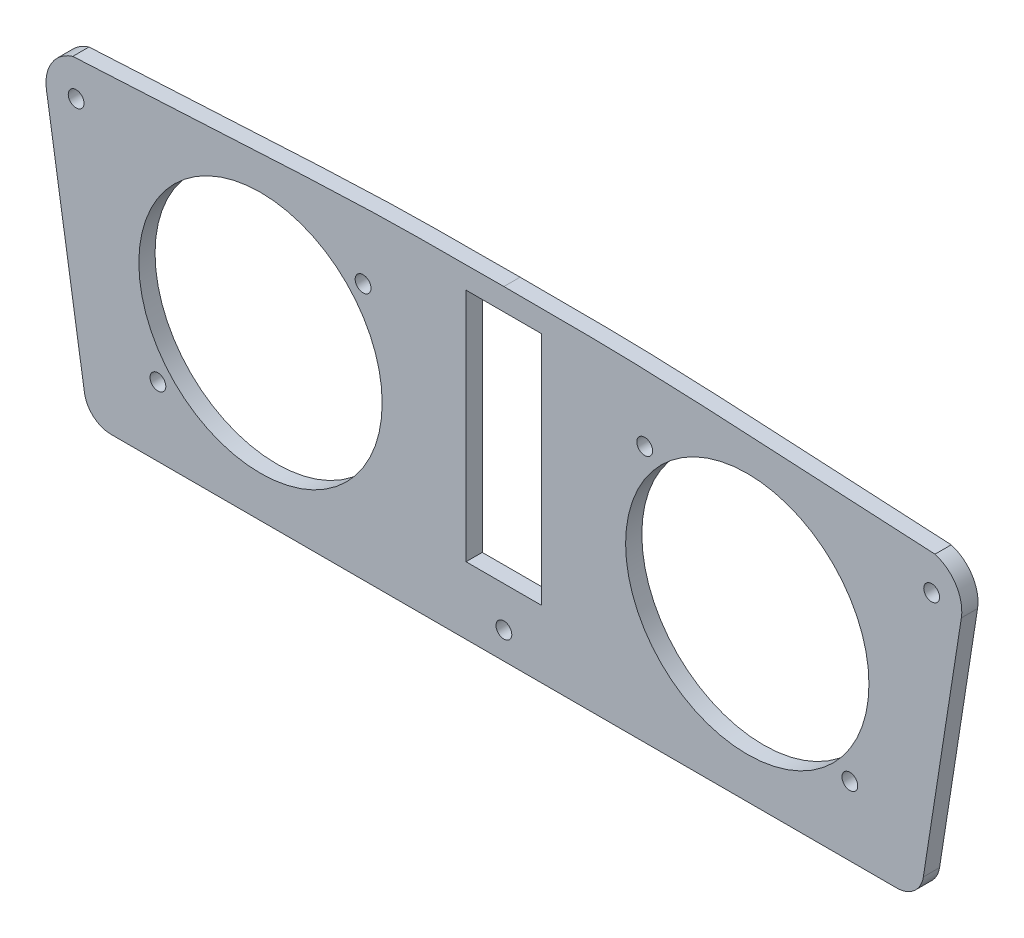
from build123d import *

# Parameters (mm, degrees)
SALIENTE_EXTRUIR3_DEPTH     = 3
CROQUIS12_R                 = 22.5
CORTAR_EXTRUIR1_DEPTH       = 3
TALADRO_DE_MARGEN_PARA_32_D = 2.921
TALADRO_DE_MARGEN_PARA_33_D = 2.921
TALADRO_DE_MARGEN_PARA_34_D = 2.921
CORTAR_EXTRUIR2_DEPTH       = 10


with BuildPart() as part:
    # Croquis1 → Saliente-Extruir3 (new body)
    with BuildSketch(Plane.XY):
        with BuildLine():
            Line((72.6209879, -42.713924632), (-72.6209879, -42.713924632))
            ThreePointArc((-72.6209879, -42.713924632), (-75.872299777, -41.512473181), (-77.561094305, -38.485513064))
            Line((-77.561094305, -38.485513064), (-84.58908741, 6.511317248))
            ThreePointArc((-84.58908741, 6.511317248), (-83.604933224, 11.307915351), (-79.718228228, 14.286075368))
            add(Edge.make_bspline(
                [(-79.718228228, 14.286075368), (-25, 17.286075368), (0, 17.286075368)],
                knots=[0, 0, 0, 1, 1, 1], degree=2, weights=[1, 3, 1]))
            add(Edge.make_bspline(
                [(79.718228228, 14.286075368), (25, 17.286075368), (0, 17.286075368)],
                knots=[0, 0, 0, 1, 1, 1], degree=2, weights=[1, 3, 1]))
            ThreePointArc((79.718228228, 14.286075368), (83.604933224, 11.307915351), (84.58908741, 6.511317248))
            Line((84.58908741, 6.511317248), (77.561094305, -38.485513064))
            ThreePointArc((77.561094305, -38.485513064), (75.872299777, -41.512473181), (72.6209879, -42.713924632))
        make_face()
    extrude(amount=SALIENTE_EXTRUIR3_DEPTH)

    # Croquis12 → Cortar-Extruir1 (cut)
    with BuildSketch(Plane.XY.offset(3)):
        with Locations((-45.004967788, -12.63149749)):
            Circle(CROQUIS12_R)
        with Locations((45.004967788, -12.63149749)):
            Circle(CROQUIS12_R)
    extrude(amount=-CORTAR_EXTRUIR1_DEPTH, mode=Mode.SUBTRACT)

    # Taladro de margen para #32 (through all)
    with Locations(Plane(origin=(-26.037185737, 4.709587945, 0), x_dir=(-1, 0, 0), z_dir=(0, 0, -1))):
        with Locations((0, 0), (37.935564102, -34.682170869), (-52.074371474, 0), (-90.009935576, -34.682170869)):
            Hole(TALADRO_DE_MARGEN_PARA_32_D / 2)

    # Taladro de margen para #33 (through all)
    with Locations(Plane(origin=(0, -37.713924632, 0), x_dir=(-1, 0, 0), z_dir=(0, 0, -1))):
        with Locations((0, 0)):
            Hole(TALADRO_DE_MARGEN_PARA_33_D / 2)

    # Taladro de margen para #34 (through all)
    with Locations(Plane(origin=(79.096485455, 7.800604527, 0), x_dir=(-1, 0, 0), z_dir=(0, 0, -1))):
        with Locations((0, 0), (158.19297091, 0)):
            Hole(TALADRO_DE_MARGEN_PARA_34_D / 2)

    # Croquis16 → Cortar-Extruir2 (cut)
    with BuildSketch(Plane.XY.offset(3)):
        Polygon((0, 13.210639363), (-7, 13.210639363), (-7, -30.288459084), (7, -30.288459084), (7, 13.210639363), align=None)
    extrude(amount=-CORTAR_EXTRUIR2_DEPTH, mode=Mode.SUBTRACT)


solid = part.part
